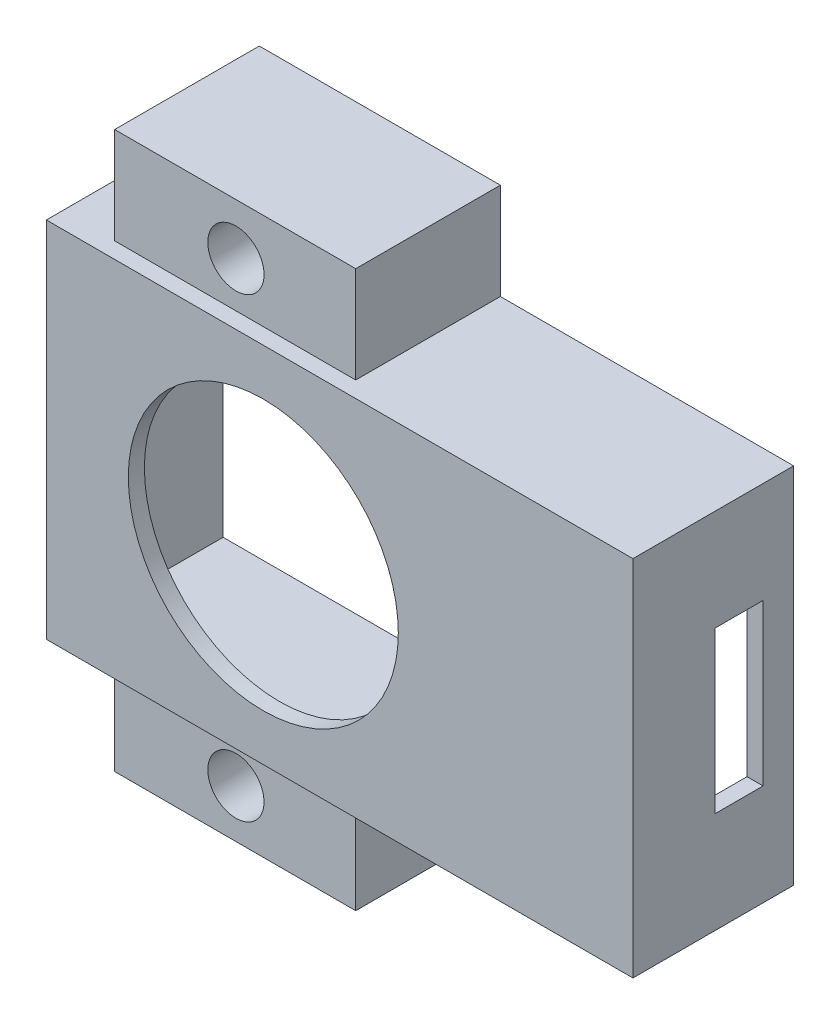
from build123d import *

# Parameters (mm, degrees)
SKETCH1_W           = 36.5
SKETCH1_H           = 22.6
BOSS_EXTRUDE2_DEPTH = 10
SHELL2_T            = -1
SKETCH2_R           = 8.4
CUT_EXTRUDE1_DEPTH  = 10
SKETCH3_W           = 3
SKETCH3_H           = 10
CUT_EXTRUDE3_DEPTH  = 10
SKETCH4_W           = 15
SKETCH4_H           = 6
BOSS_EXTRUDE3_DEPTH = 9
SKETCH5_R           = 1.75
CUT_EXTRUDE4_DEPTH  = 18


with BuildPart() as part:
    # Sketch1 → Boss-Extrude2 (new body)
    with BuildSketch(Plane.XY):
        Rectangle(SKETCH1_W, SKETCH1_H)
    extrude(amount=BOSS_EXTRUDE2_DEPTH)

    # Shell2
    shell2_openings = [part.faces().sort_by_distance(p)[0] for p in [
        (0, 0, 0),
    ]]
    offset(amount=SHELL2_T, openings=shell2_openings, kind=Kind.INTERSECTION)

    # Sketch2 → Cut-Extrude1 (cut)
    with BuildSketch(Plane(origin=(0, 0, 9), x_dir=(-1, 0, 0), z_dir=(0, 0, -1))):
        with Locations((4.75, 0)):
            Circle(SKETCH2_R)
    extrude(amount=-CUT_EXTRUDE1_DEPTH, mode=Mode.SUBTRACT)

    # Sketch3 → Cut-Extrude3 (cut)
    with BuildSketch(Plane(origin=(18.25, 0, 0), x_dir=(0, 0, -1), z_dir=(1, 0, 0))):
        with Locations((-3.4, 0)):
            Rectangle(SKETCH3_W, SKETCH3_H)
    extrude(amount=-CUT_EXTRUDE3_DEPTH, mode=Mode.SUBTRACT)

    # Sketch4 → Boss-Extrude3 (add)
    with BuildSketch(Plane(origin=(0, 0, 9), x_dir=(-1, 0, 0), z_dir=(0, 0, -1))):
        with Locations((7.5, 14.3)):
            Rectangle(SKETCH4_W, SKETCH4_H)
        with Locations((7.5, -14.3)):
            Rectangle(SKETCH4_W, SKETCH4_H)
    extrude(amount=BOSS_EXTRUDE3_DEPTH)

    # Sketch5 → Cut-Extrude4 (cut)
    with BuildSketch(Plane(origin=(0, 0, 0), x_dir=(-1, 0, 0), z_dir=(0, 0, -1))):
        with Locations((7.455294422, 14.124015169)):
            Circle(SKETCH5_R)
        with Locations((7.455294422, -14.296167592)):
            Circle(SKETCH5_R)
    extrude(amount=-CUT_EXTRUDE4_DEPTH, mode=Mode.SUBTRACT)


solid = part.part
